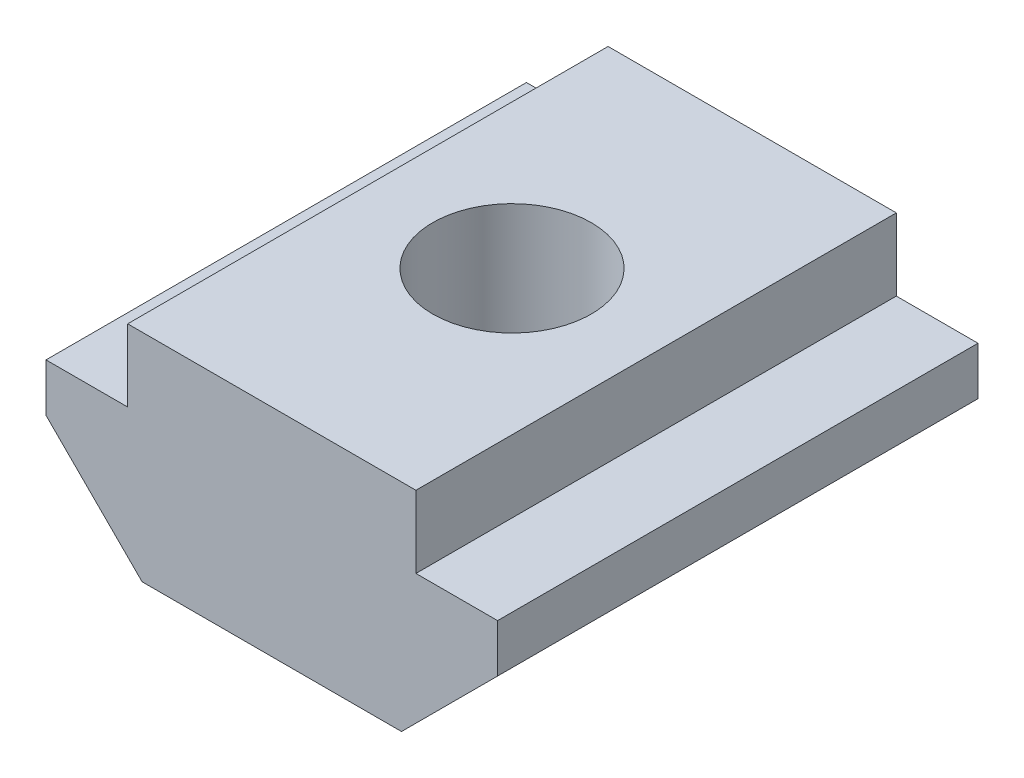
from build123d import *

# Parameters (mm, degrees)
EXTRUDE_1_DEPTH    = 10
HOLE_WIZARD_M4_1_D = 3.3


with BuildPart() as part:
    # 草图1 → 拉伸1 (new body)
    with BuildSketch(Plane.XY):
        Polygon((0, 0), (1.7, 0), (1.7, 1.5), (7.7, 1.5), (7.7, 0), (9.4, 0), (9.4, -1), (7.4, -3), (2, -3), (0, -1), align=None)
    extrude(amount=EXTRUDE_1_DEPTH)

    # M4 螺纹孔1 (through all)
    with Locations(Plane(origin=(4.7, 1.5, 5), x_dir=(0, 0, 1), z_dir=(0, 1, 0))):
        with Locations((0, 0)):
            Hole(HOLE_WIZARD_M4_1_D / 2)


solid = part.part
